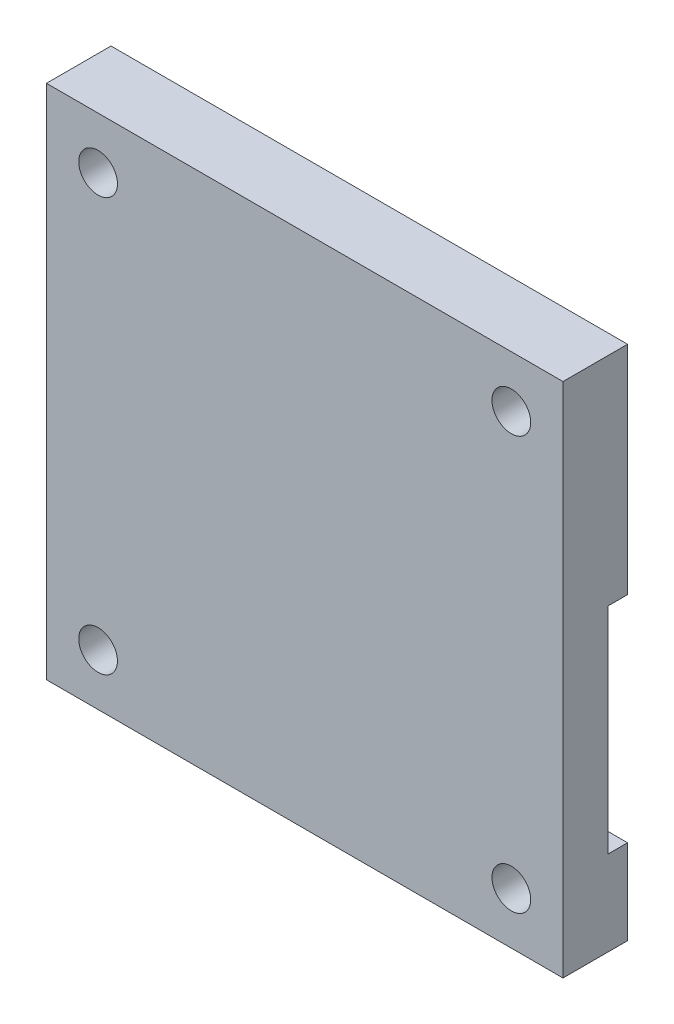
from build123d import *

# Parameters (mm, degrees)
SKETCH1_W           = 40
SKETCH1_H           = 40
SKETCH1_R           = 1.5
BOSS_EXTRUDE1_DEPTH = 5
SKETCH3_W           = 40
SKETCH3_H           = 16.636061704
CUT_EXTRUDE1_DEPTH  = 1.5


with BuildPart() as part:
    # Sketch1 → Boss-Extrude1 (new body)
    with BuildSketch(Plane.XY):
        Rectangle(SKETCH1_W, SKETCH1_H)
        with Locations((-16, 16)):
            Circle(SKETCH1_R, mode=Mode.SUBTRACT)
        with Locations((16, 16)):
            Circle(SKETCH1_R, mode=Mode.SUBTRACT)
        with Locations((-16, -16)):
            Circle(SKETCH1_R, mode=Mode.SUBTRACT)
        with Locations((16, -16)):
            Circle(SKETCH1_R, mode=Mode.SUBTRACT)
    extrude(amount=BOSS_EXTRUDE1_DEPTH)

    # Sketch3 → Cut-Extrude1 (cut)
    with BuildSketch(Plane(origin=(0, 0, 0), x_dir=(-1, 0, 0), z_dir=(0, 0, -1))):
        with Locations((0, -5.111977567)):
            Rectangle(SKETCH3_W, SKETCH3_H)
    extrude(amount=-CUT_EXTRUDE1_DEPTH, mode=Mode.SUBTRACT)


solid = part.part
